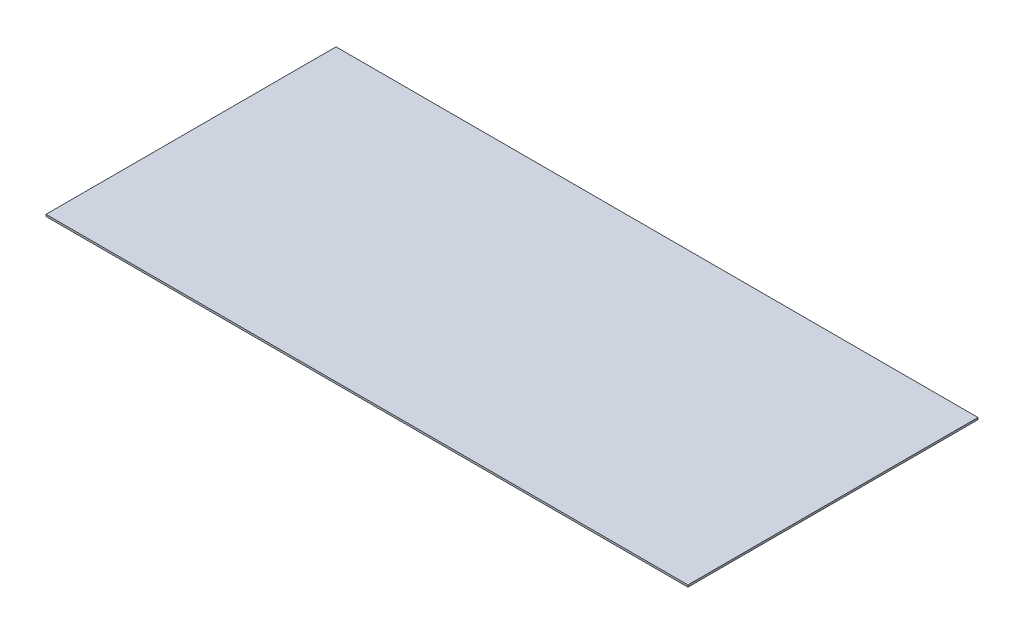
from build123d import *

# Parameters (mm, degrees)
SKETCH1_W           = 166
SKETCH1_H           = 75
BOSS_EXTRUDE1_DEPTH = 0.5


with BuildPart() as part:
    # Sketch1 → Boss-Extrude1 (new body)
    with BuildSketch(Plane(origin=(0, 0, 0), x_dir=(1, 0, 0), z_dir=(0, 1, 0))):
        with Locations((83, 37.5)):
            Rectangle(SKETCH1_W, SKETCH1_H)
    extrude(amount=BOSS_EXTRUDE1_DEPTH)


solid = part.part
